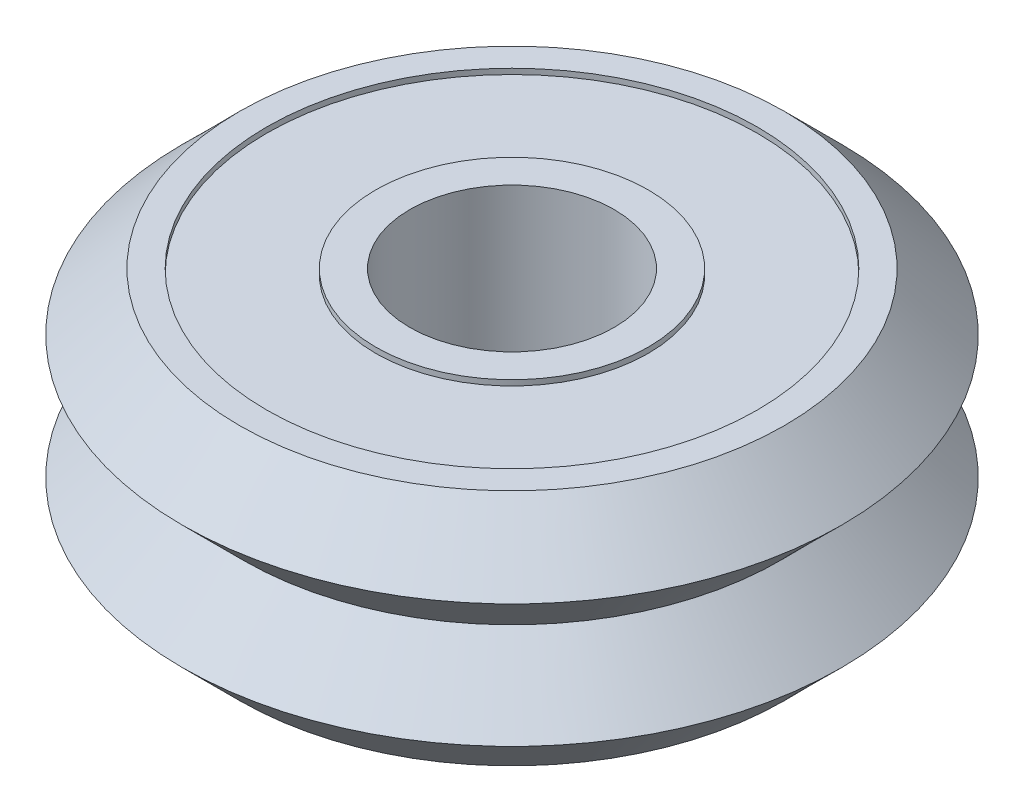
from build123d import *


with BuildPart() as part:
    # Sketch1 → Revolve1 (revolve)
    with BuildSketch(Plane.XY, mode=Mode.PRIVATE) as revolve1_sk:
        Polygon((-12.69, 5.55), (-15.365, 2.875), (-12.49, 0), (-15.365, -2.875), (-12.69, -5.55), (-11.43, -5.55), (-11.43, -5.296), (-6.35, -5.296), (-6.35, -5.55), (-4.7625, -5.55), (-4.7625, 5.55), (-6.35, 5.55), (-6.35, 5.296), (-11.43, 5.296), (-11.43, 5.55), align=None)
    revolve(revolve1_sk.sketch.rotate(Axis((0, 0, 0), (0, -1, 0)), 270), axis=Axis((0, 0, 0), (0, -1, 0)))


solid = part.part
